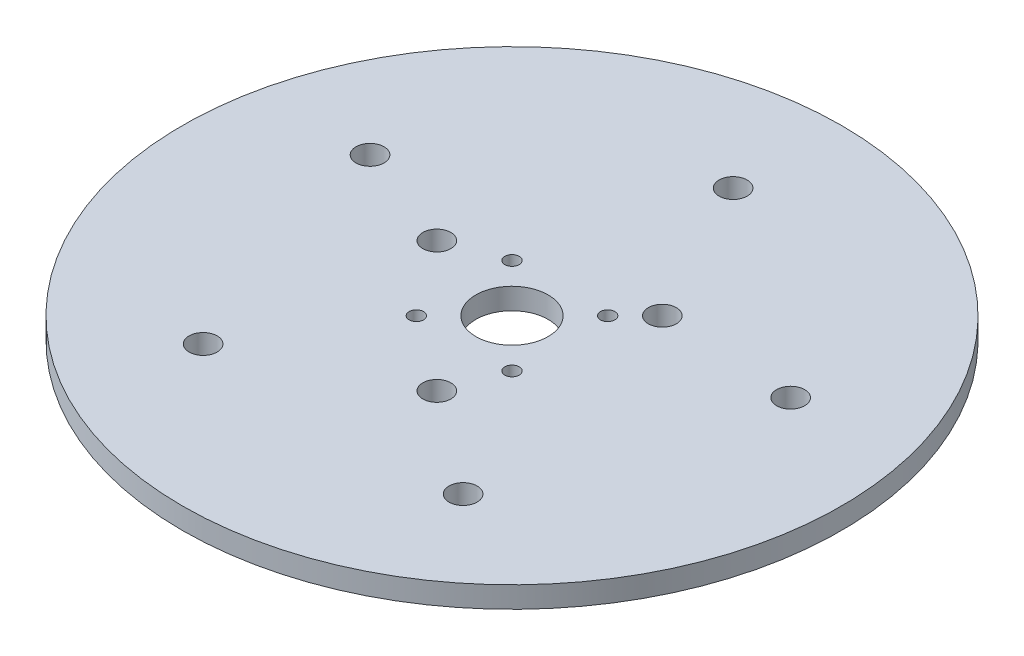
from build123d import *

# Parameters (mm, degrees)
SKETCH1_R            = 77.5
SKETCH1_R_2          = 8.5
BODY_DEPTH           = 5
M6_CLEARANCE_HOLE1_D = 6.6
M3_CLEARANCE_HOLE1_D = 3.4
M6_CLEARANCE_HOLE2_D = 6.6


with BuildPart() as part:
    # Sketch1 → Body (new body)
    with BuildSketch(Plane(origin=(0, 0, 0), x_dir=(1, 0, 0), z_dir=(0, 1, 0))):
        with Locations(Location((0, 0, 0), (0, 0, 270))):
            Circle(SKETCH1_R)
        with Locations(Location((0, 0, 0), (0, 0, 270))):
            Circle(SKETCH1_R_2, mode=Mode.SUBTRACT)
    extrude(amount=BODY_DEPTH)

    # M6 Clearance Hole1 (through all)
    with Locations(Plane(origin=(0, 5, 0), x_dir=(1, 0, 0), z_dir=(0, 1, 0))):
        with Locations((0, 52), (49.454938847, 16.068883707), (30.564833119, -42.068883707), (-30.564833119, -42.068883707), (-49.454938847, 16.068883707), (0, 0)):
            Hole(M6_CLEARANCE_HOLE1_D / 2)

    # M3 Clearance Hole1 (through all)
    with Locations(Plane(origin=(0, 5, 0), x_dir=(1, 0, 0), z_dir=(0, 1, 0))):
        with Locations((0, 0), (-11.25, 11.25), (11.25, -11.25), (11.25, 11.25), (-11.25, -11.25)):
            Hole(M3_CLEARANCE_HOLE1_D / 2)

    # M6 Clearance Hole2 (through all)
    with Locations(Plane(origin=(0, 5, 0), x_dir=(1, 0, 0), z_dir=(0, 1, 0))):
        with Locations((17.67766953, 17.67766953), (6.470476128, -24.148145657), (-24.148145657, 6.470476128), (0, 0)):
            Hole(M6_CLEARANCE_HOLE2_D / 2)


solid = part.part
